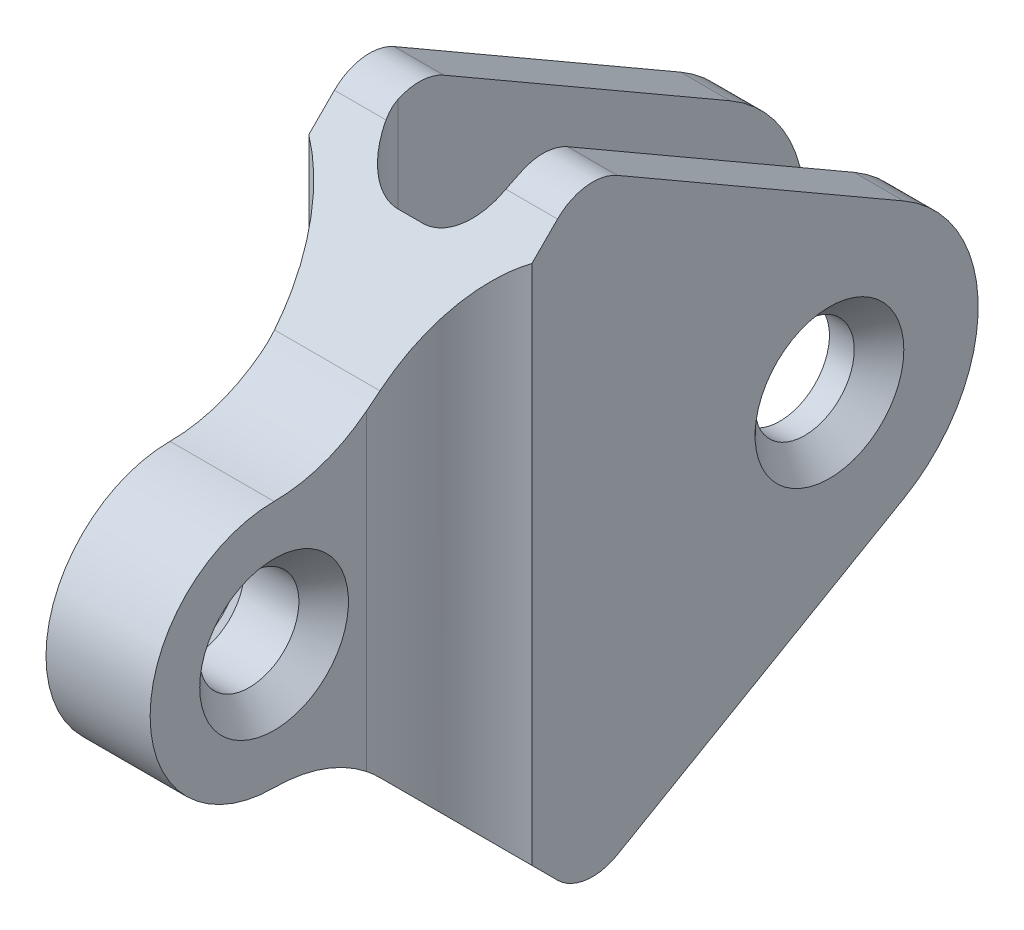
from build123d import *

# Parameters (mm, degrees)
SKETCH1_R               = 10
BOSS_EXTRUDE1_DEPTH     = 22.5
CUT_EXTRUDE1_DEPTH      = 141.755212167
CUT_EXTRUDE1_DEPTH_BACK = 141.755212167
CHAMFER1_SIZE           = 5


with BuildPart() as part:
    # Sketch1 → Boss-Extrude1 (new, symmetric)
    with BuildSketch(Plane.YZ):
        with BuildLine():
            Line((25.980762114, -15), (59.329684168, 42.762027375))
            ThreePointArc((59.329684168, 42.762027375), (60.583878744, 49.067289298), (57.740497942, 54.833095187))
            Line((57.740497942, 54.833095187), (33.786796564, 78.786796564))
            ThreePointArc((33.786796564, 78.786796564), (27.283614025, 88.519497029), (25, 100))
            ThreePointArc((25, 100), (0, 125), (-25, 100))
            ThreePointArc((-25, 100), (-27.283614025, 88.519497029), (-33.786796564, 78.786796564))
            Line((-33.786796564, 78.786796564), (-57.740497942, 54.833095187))
            ThreePointArc((-57.740497942, 54.833095187), (-60.583878744, 49.067289298), (-59.329684168, 42.762027375))
            Line((-59.329684168, 42.762027375), (-25.980762114, -15))
            ThreePointArc((-25.980762114, -15), (0, -30), (25.980762114, -15))
        make_face()
        with Locations(Location((0, 0, 0), (0, 0, 90))):
            Circle(SKETCH1_R, mode=Mode.SUBTRACT)
        with Locations(Location((0, 100, 0), (0, 0, 90))):
            Circle(SKETCH1_R, mode=Mode.SUBTRACT)
    extrude(amount=BOSS_EXTRUDE1_DEPTH, both=True)

    # Sketch2 → Cut-Extrude1 (cut, two sides: drawn at the far end of the back side and taken through both)
    with BuildSketch(Plane(origin=(0, 0, 0), x_dir=(-1, 0, 0), z_dir=(0, 1, 0)).offset(-CUT_EXTRUDE1_DEPTH_BACK)):
        with BuildLine():
            Line((-22.5, 125), (-10.5, 125))
            Line((-10.5, 125), (-10.5, 81.354156504))
            ThreePointArc((-10.5, 81.354156504), (-13.705505282, 69.10670779), (-22.5, 60))
            Line((-22.5, 60), (-22.5, 125))
        make_face()
        with BuildLine():
            Line((22.5, 60), (22.5, 125))
            Line((22.5, 125), (10.5, 125))
            Line((10.5, 125), (10.5, 81.354156504))
            ThreePointArc((10.5, 81.354156504), (13.705505282, 69.10670779), (22.5, 60))
        make_face()
        with BuildLine():
            Line((-12.5, -30), (-12.5, 52))
            ThreePointArc((-12.5, 52), (-9.571067812, 59.071067812), (-2.5, 62))
            Line((-2.5, 62), (2.5, 62))
            ThreePointArc((2.5, 62), (9.571067812, 59.071067812), (12.5, 52))
            Line((12.5, 52), (12.5, -30))
            Line((12.5, -30), (-12.5, -30))
        make_face()
    extrude(amount=CUT_EXTRUDE1_DEPTH + CUT_EXTRUDE1_DEPTH_BACK, mode=Mode.SUBTRACT)

    # Chamfer1
    chamfer1_edges = [part.edges().sort_by_distance(p)[0] for p in [
        (10.5, 0, 90),
        (-22.5, 0, -10),
        (22.5, 0, -10),
        (-10.5, 0, 90),
    ]]
    chamfer(chamfer1_edges, length=CHAMFER1_SIZE)


solid = part.part
